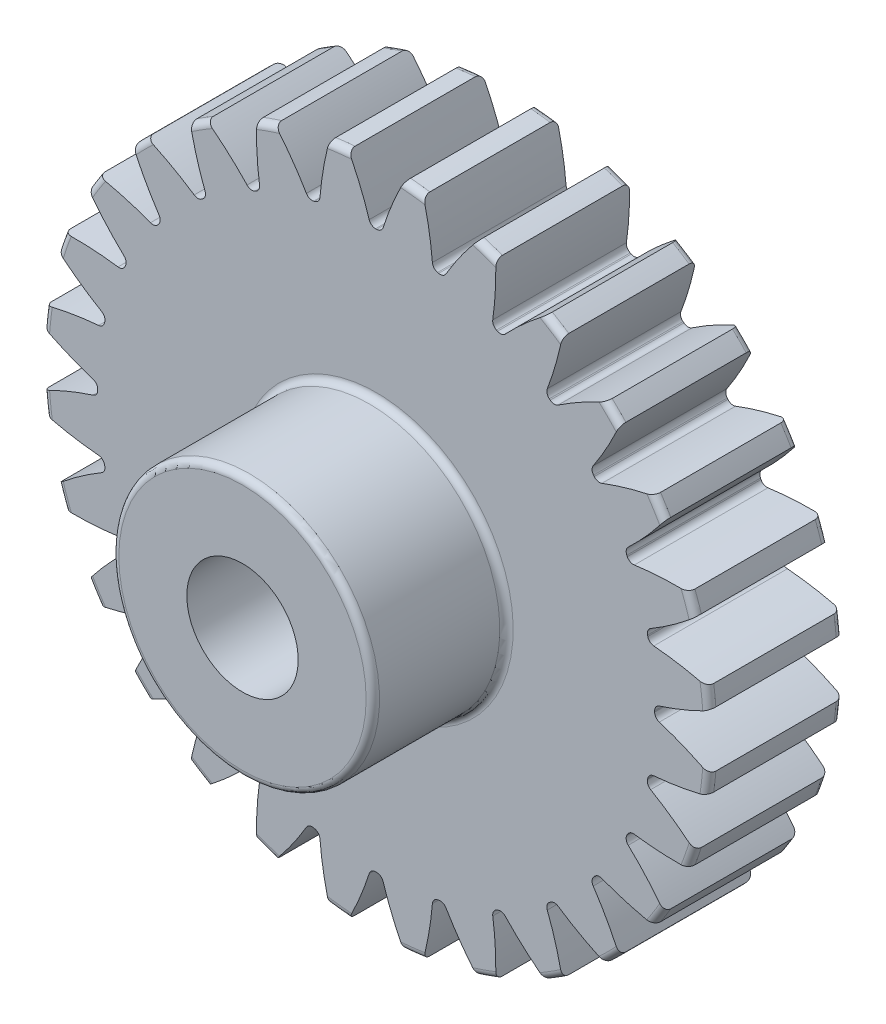
from build123d import *

# Parameters (mm, degrees)
FILLET2_R          = 0.3
CUT_EXTRUDE2_DEPTH = 23.045407753
CIRPATTERN1_COUNT  = 28


with BuildPart() as part:
    # Sketch4 → Revolve1 (revolve)
    with BuildSketch(Plane(origin=(0, 0, 0), x_dir=(0, 0, -1), z_dir=(1, 0, 0))):
        Polygon((-12, 2.5), (-12, 5.85), (-6, 5.85), (-6, 15), (0, 15), (0, 2.5), align=None)
    revolve(axis=Axis((0, 0, 6), (0, 0, 1)))

    # Fillet2
    fillet2_edges = [part.edges().sort_by_distance(p)[0] for p in [
        (0, -15, 0),
        (0, -15, 6),
        (0, -5.85, 6),
        (0, -5.85, 12),
    ]]
    fillet(fillet2_edges, radius=FILLET2_R)

    # Sketch7 → Cut-Extrude2 (cut, through all)
    with BuildSketch(Plane.XY.offset(6)):
        with BuildLine():
            ThreePointArc((-0.025496618, 12.499973997), (0, 12.5), (0.025496618, 12.499973997))
            ThreePointArc((0.025496618, 12.499973997), (0.20290931, 12.557601716), (0.311976438, 12.708931088))
            ThreePointArc((0.311976438, 12.708931088), (0.730354881, 13.848818268), (1.245930915, 14.948165645))
            ThreePointArc((1.245930915, 14.948165645), (0, 15), (-1.245930915, 14.948165645))
            ThreePointArc((-1.245930915, 14.948165645), (-0.730354881, 13.848818268), (-0.311976438, 12.708931088))
            ThreePointArc((-0.311976438, 12.708931088), (-0.20290931, 12.557601716), (-0.025496618, 12.499973997))
        make_face()
    cut_extrude2 = extrude(amount=-CUT_EXTRUDE2_DEPTH, mode=Mode.SUBTRACT)

    # CirPattern1: Cut-Extrude2 ×28 about axis
    cirpattern1_axis = Axis((0, 0, 0), (0, 0, 1))
    for i in range(1, CIRPATTERN1_COUNT):
        add(cut_extrude2.rotate(cirpattern1_axis, i * 360 / CIRPATTERN1_COUNT), mode=Mode.SUBTRACT)


solid = part.part
